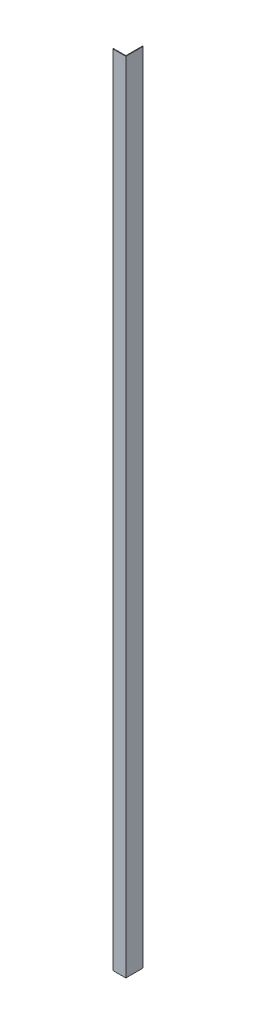
from build123d import *

# Parameters (mm, degrees)
PRESS_SOVE_SOL_1_START = 120
PRESS_SOVE_SOL_1_DEPTH = 1850


with BuildPart() as part:
    # Sketch1 → PRESS_sove_sol_1 (new body)
    with BuildSketch(Plane(origin=(0, 0, 0), x_dir=(1, 0, 0), z_dir=(0, 1, 0)).offset(PRESS_SOVE_SOL_1_START)):
        Polygon((0, -40), (0, -38.5), (28.5, -38.5), (28.5, 0), (30, 0), (30, -40), align=None)
    extrude(amount=PRESS_SOVE_SOL_1_DEPTH)


solid = part.part
